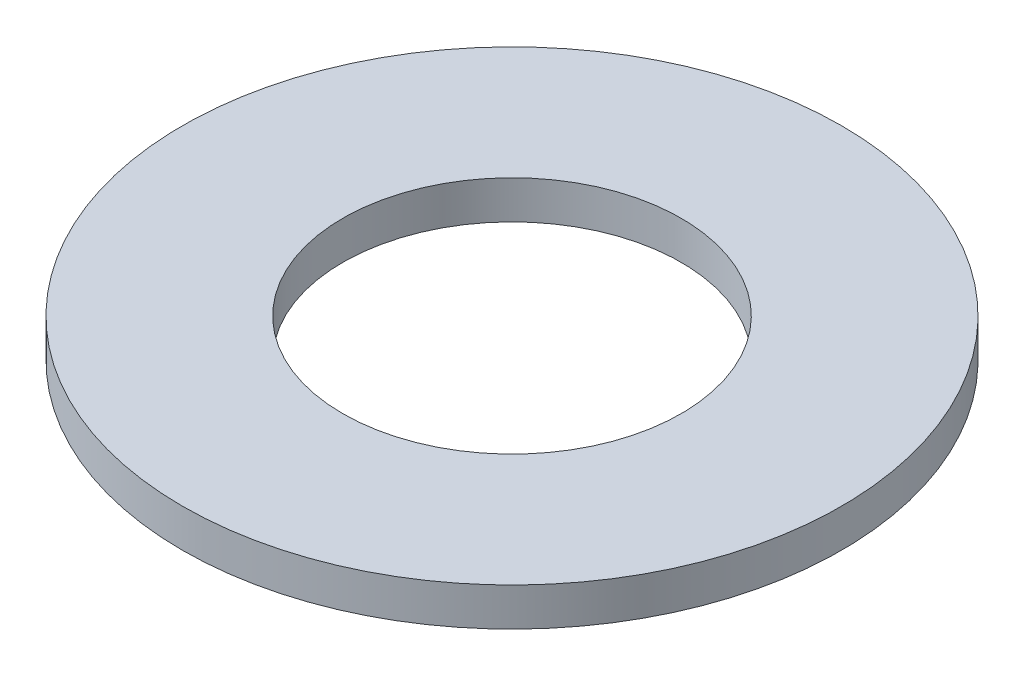
from build123d import *

# Parameters (mm, degrees)
SKETCH1_R            = 4.3815
BOSS_EXTRUDE1_DEPTH  = 0.508
M4_CLEARANCE_HOLE1_D = 4.5


with BuildPart() as part:
    # Sketch1 → Boss-Extrude1 (new body)
    with BuildSketch(Plane(origin=(0, 0, 0), x_dir=(1, 0, 0), z_dir=(0, 1, 0))):
        with Locations(Location((0, 0, 0), (0, 0, 270))):
            Circle(SKETCH1_R)
    extrude(amount=BOSS_EXTRUDE1_DEPTH)

    # M4 Clearance Hole1 (through all)
    with Locations(Plane(origin=(0, 0.508, 0), x_dir=(1, 0, 0), z_dir=(0, 1, 0))):
        with Locations((0, 0)):
            Hole(M4_CLEARANCE_HOLE1_D / 2)


solid = part.part
